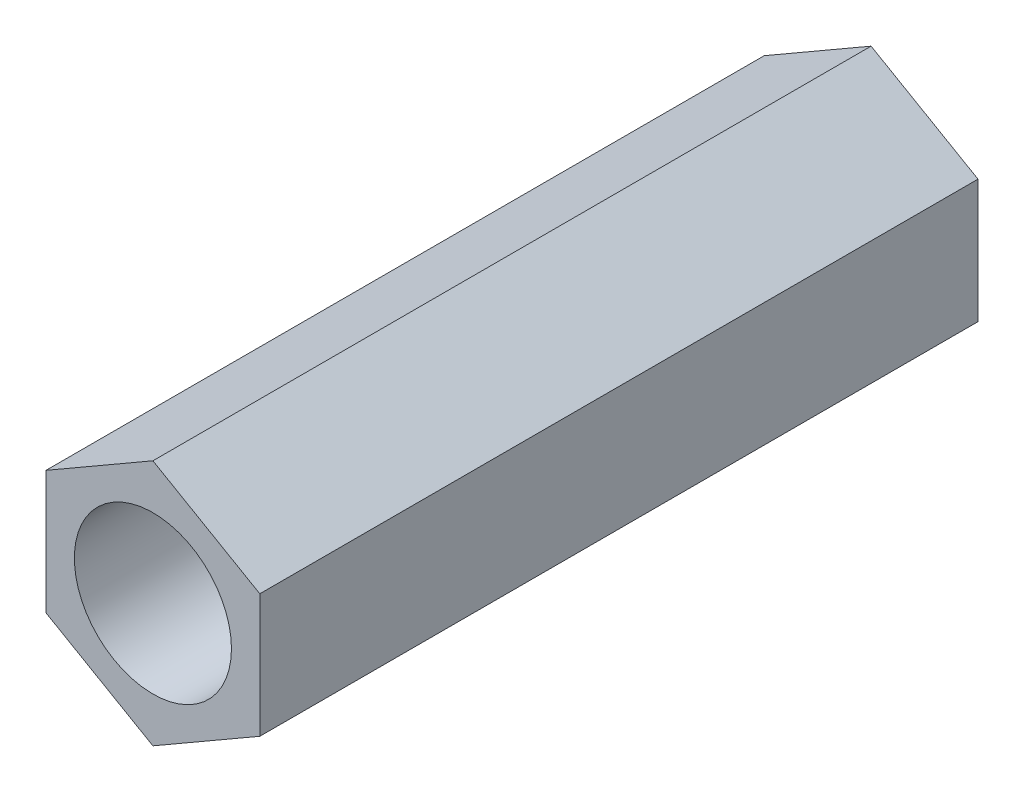
from build123d import *

# Parameters (mm, degrees)
BOSS_EXTRUDE1_DEPTH = 16
SKETCH2_R           = 1.75
CUT_EXTRUDE1_DEPTH  = 17.408362959


with BuildPart() as part:
    # Sketch1 → Boss-Extrude1 (new body)
    with BuildSketch(Plane.XY):
        Polygon((0, 2.75), (-2.38156986, 1.375), (-2.38156986, -1.375), (0, -2.75), (2.38156986, -1.375), (2.38156986, 1.375), align=None)
    extrude(amount=BOSS_EXTRUDE1_DEPTH)

    # Sketch2 → Cut-Extrude1 (cut, through all)
    with BuildSketch(Plane.XY.offset(16)):
        Circle(SKETCH2_R)
    extrude(amount=-CUT_EXTRUDE1_DEPTH, mode=Mode.SUBTRACT)


solid = part.part
